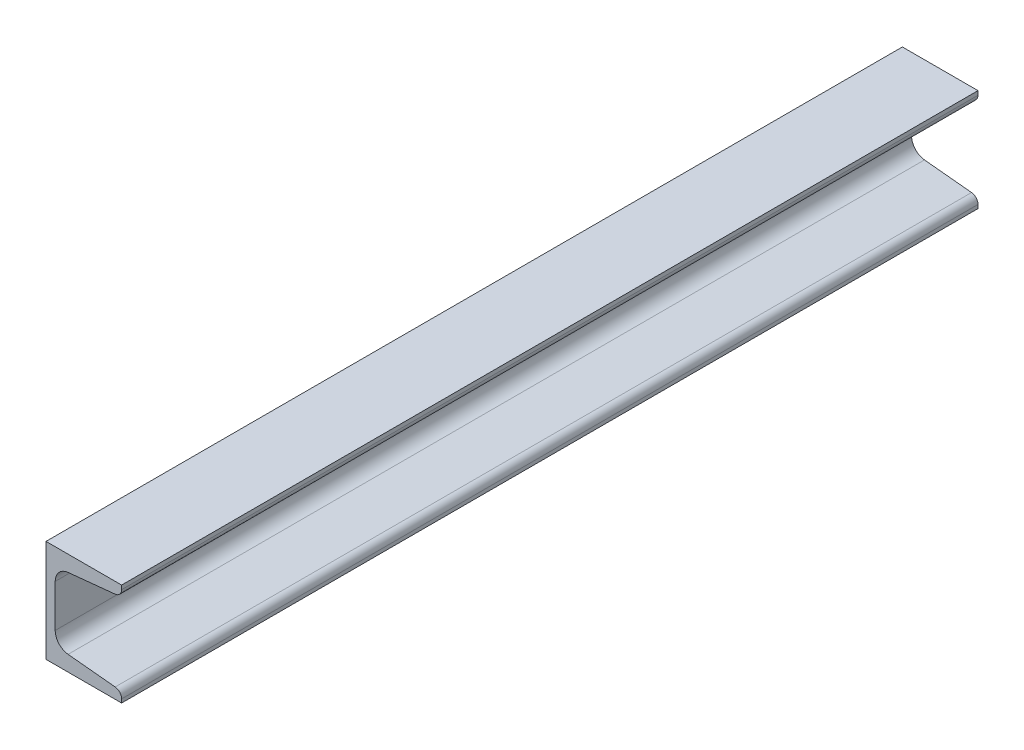
from build123d import *

# Parameters (mm, degrees)
EXTRUDE_1_DEPTH = 419


with BuildPart() as part:
    # 草图1 → 凸台-拉伸1 (new body)
    with BuildSketch(Plane.XY):
        with BuildLine():
            Line((0, 0), (0, 50))
            Line((0, 50), (37, 50))
            Line((37, 50), (37, 48.040012398))
            ThreePointArc((37, 48.040012398), (36.095083867, 45.691493776), (33.848263017, 44.557382233))
            Line((33.848263017, 44.557382233), (10.803473967, 42.252903328))
            ThreePointArc((10.803473967, 42.252903328), (6.309832265, 39.984680242), (4.5, 35.287642996))
            Line((4.5, 35.287642996), (4.5, 14.509912935))
            ThreePointArc((4.5, 14.509912935), (6.309832265, 9.812875689), (10.803473967, 7.544652603))
            Line((10.803473967, 7.544652603), (33.848263017, 5.240173698))
            ThreePointArc((33.848263017, 5.240173698), (36.095083867, 4.106062155), (37, 1.757543533))
            Line((37, 1.757543533), (37, 0))
            Line((37, 0), (0, 0))
        make_face()
    extrude(amount=EXTRUDE_1_DEPTH)


solid = part.part
